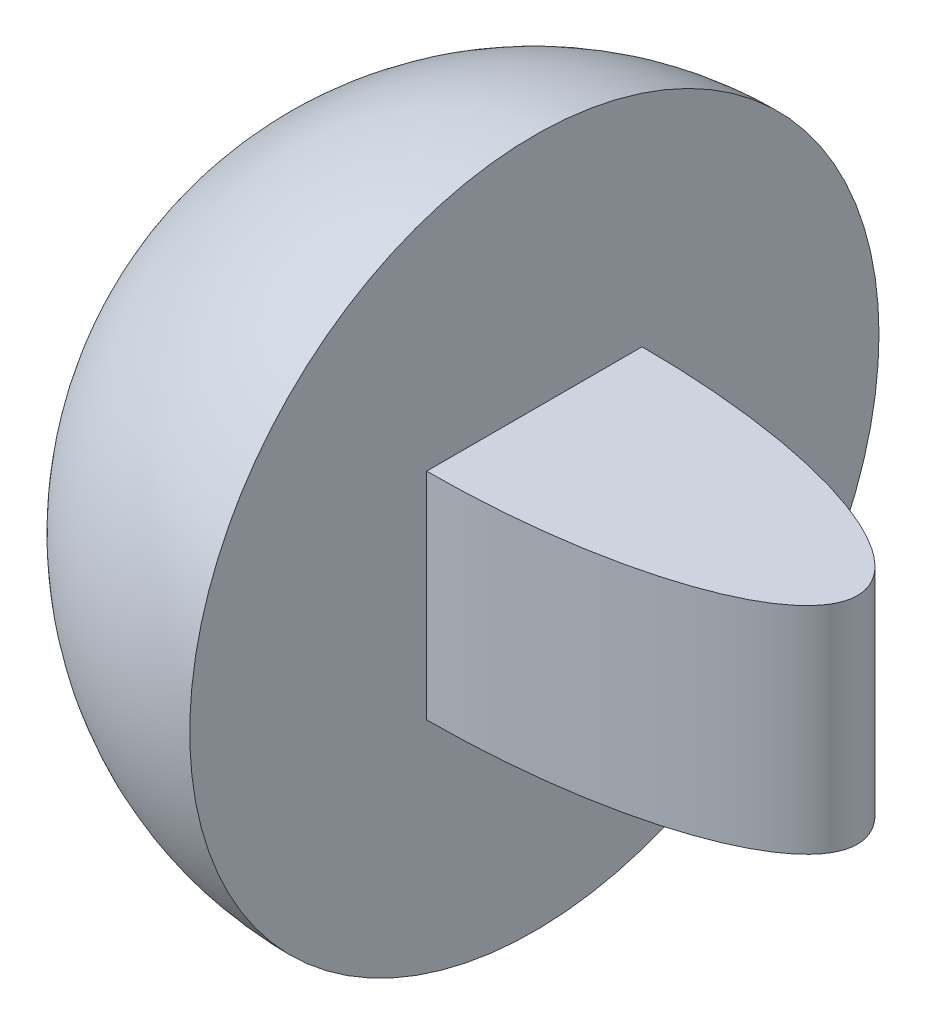
from build123d import *

# Parameters (mm, degrees)
BOSS_EXTRUDE1_DEPTH      = 25
BOSS_EXTRUDE1_DEPTH_BACK = 25
SKETCH1_RX               = 75
SKETCH1_RY               = 25


with BuildPart() as part:
    # Sketch1 → Boss-Extrude1 (new, two sides: drawn at the far end of the back side and taken through both)
    with BuildSketch(Plane(origin=(0, 0, 0), x_dir=(1, 0, 0), z_dir=(0, 1, 0)).offset(-BOSS_EXTRUDE1_DEPTH_BACK)):
        with Locations((0, 0)):
            Ellipse(SKETCH1_RX, SKETCH1_RY)
    extrude(amount=BOSS_EXTRUDE1_DEPTH + BOSS_EXTRUDE1_DEPTH_BACK)

    # Sketch3 → Revolve1 (revolve)
    with BuildSketch(Plane(origin=(0, 0, 0), x_dir=(1, 0, 0), z_dir=(0, 1, 0))):
        with BuildLine():
            Line((0, 0), (-80, 0))
            add(Edge.make_bspline(
                [(0, 80), (-80, 80), (-80, 0)],
                knots=[1.570796327, 1.570796327, 1.570796327, 3.141592654, 3.141592654, 3.141592654], degree=2, weights=[1, 0.707106781, 1]))
            Line((0, 80), (0, 0))
        make_face()
    revolve(axis=Axis((0, 0, 0), (-1, 0, 0)))


solid = part.part
